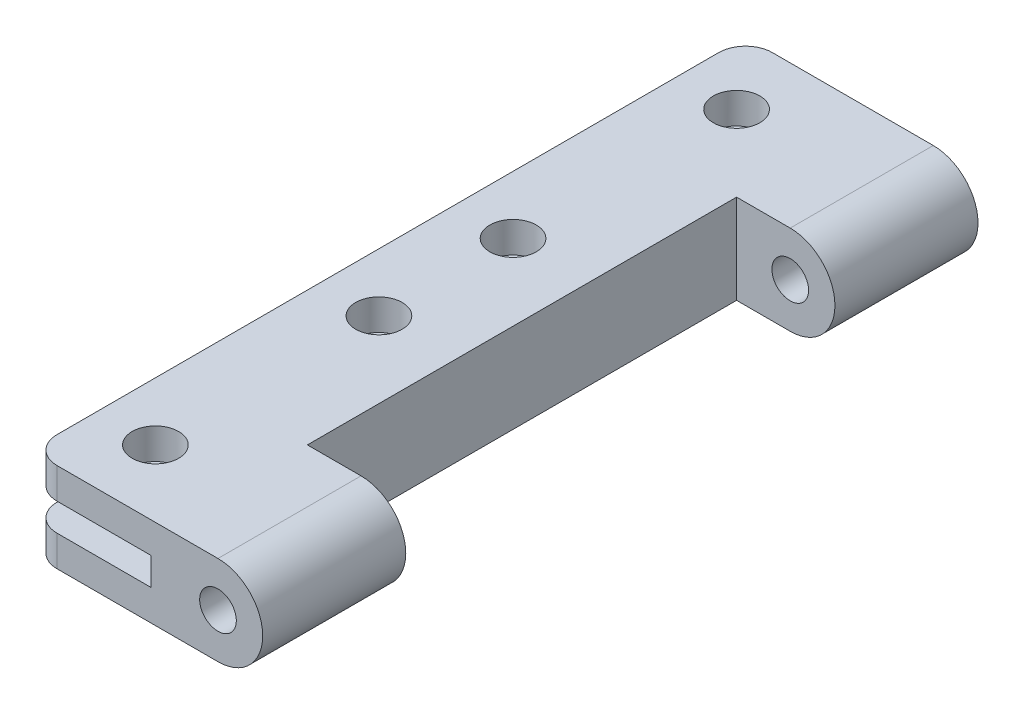
from build123d import *

# Parameters (mm, degrees)
SKETCH_1_R          = 2.05
EXTRUDE_1_DEPTH     = 80
SKETCH_2_W          = 13.5
SKETCH_2_H          = 3.1
CUT_EXTRUDE_1_DEPTH = 95
SKETCH_4_R          = 2.6
CUT_EXTRUDE_2_DEPTH = 20
SKETCH_5_W          = 32.115933716
SKETCH_5_H          = 48
CUT_EXTRUDE_5_DEPTH = 20
FILLET_1_R          = 3


with BuildPart() as part:
    # 草图1 → 凸台-拉伸1 (new body)
    with BuildSketch(Plane.XY):
        with BuildLine():
            Line((0, 5), (21, 5))
            ThreePointArc((21, 5), (26, 0), (21, -5))
            Line((21, -5), (0, -5))
            Line((0, -5), (0, 5))
        make_face()
        with Locations(Location((21, 0, 0), (0, 0, 180))):
            Circle(SKETCH_1_R, mode=Mode.SUBTRACT)
    extrude(amount=EXTRUDE_1_DEPTH)

    # 草图2 → 切除-拉伸1 (cut)
    with BuildSketch(Plane.XY.offset(80)):
        with Locations((6.75, 0)):
            Rectangle(SKETCH_2_W, SKETCH_2_H)
    extrude(amount=-CUT_EXTRUDE_1_DEPTH, mode=Mode.SUBTRACT)

    # 草图4 → 切除-拉伸2 (cut)
    with BuildSketch(Plane(origin=(0, 5, 0), x_dir=(1, 0, 0), z_dir=(0, 1, 0))):
        with Locations((6.5, -32.5)):
            Circle(SKETCH_4_R)
        with Locations((6.5, -7.5)):
            Circle(SKETCH_4_R)
        with Locations((6.5, -72.5)):
            Circle(SKETCH_4_R)
        with Locations((6.5, -47.5)):
            Circle(SKETCH_4_R)
    extrude(amount=-CUT_EXTRUDE_2_DEPTH, mode=Mode.SUBTRACT)

    # 草图5 → 切除-拉伸5 (cut)
    with BuildSketch(Plane(origin=(0, 5, 0), x_dir=(1, 0, 0), z_dir=(0, 1, 0))):
        with Locations((31.057966858, -40)):
            Rectangle(SKETCH_5_W, SKETCH_5_H)
    extrude(amount=-CUT_EXTRUDE_5_DEPTH, mode=Mode.SUBTRACT)

    # 圆角1
    fillet_1_edges = [part.edges().sort_by_distance(p)[0] for p in [
        (0, -3.275, 0),
        (0, -3.275, 80),
        (0, 3.275, 80),
        (0, 3.275, 0),
    ]]
    fillet(fillet_1_edges, radius=FILLET_1_R)


solid = part.part
